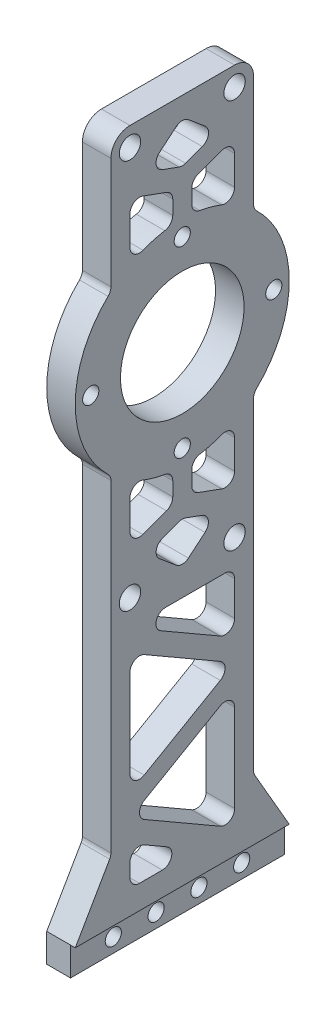
from build123d import *

# Parameters (mm, degrees)
SKETCH_1_W          = 6
SKETCH_1_H          = 30
EXTRUDE_1_DEPTH     = 177
SKETCH_2_R          = 22.5
EXTRUDE_2_DEPTH     = 6
SKETCH_3_R          = 13
CUT_EXTRUDE_1_DEPTH = 182.028312703
HOLE_WIZARD_M32_D   = 3.4
HOLE_WIZARD_M41_D   = 4.5
EXTRUDE_3_DEPTH     = 6
HOLE_WIZARD_M31_D   = 3.4
SKETCH_14_W         = 45
SKETCH_14_H         = 6
CUT_EXTRUDE_2_DEPTH = 1
SKETCH_15_W         = 30
SKETCH_15_H         = 26.9754548
CUT_EXTRUDE_3_DEPTH = 6
FILLET_1_R          = 4
CUT_EXTRUDE_4_DEPTH = 155.756628816
FILLET_3_R          = 2


with BuildPart() as part:
    # Эскиз1 → Бобышка-Вытянуть1 (new body)
    with BuildSketch(Plane(origin=(0, 0, 0), x_dir=(1, 0, 0), z_dir=(0, 1, 0))):
        with Locations((3, -15)):
            Rectangle(SKETCH_1_W, SKETCH_1_H)
    extrude(amount=EXTRUDE_1_DEPTH)

    # Эскиз2 → Бобышка-Вытянуть2 (add)
    with BuildSketch(Plane.ZY):
        with Locations((15, 105)):
            Circle(SKETCH_2_R)
    extrude(amount=-EXTRUDE_2_DEPTH)

    # Эскиз3 → Вырез-Вытянуть1 (cut, through all)
    with BuildSketch(Plane.ZY):
        with Locations((15, 105)):
            Circle(SKETCH_3_R)
    extrude(amount=-CUT_EXTRUDE_1_DEPTH, mode=Mode.SUBTRACT)

    # Отверстие с зазором M32 (through all)
    with Locations(Plane(origin=(6, -25.024735225, 7.262908886), x_dir=(0, 0, 1), z_dir=(1, 0, 0))):
        with Locations((-11.512908886, -130.024735225), (7.737091114, -110.774735225), (26.987091114, -130.024735225), (7.737091114, -149.274735225)):
            Hole(HOLE_WIZARD_M32_D / 2)

    # Отверстие с зазором M41 (through all)
    with Locations(Plane(origin=(6, 0, 0), x_dir=(0, 0, -1), z_dir=(1, 0, 0))):
        with Locations((-26, 146), (-4, 146), (-4, 64), (-26, 64)):
            Hole(HOLE_WIZARD_M41_D / 2)

    # Эскиз11 → Бобышка-Вытянуть3 (add)
    with BuildSketch(Plane(origin=(6, 0, 0), x_dir=(0, 0, -1), z_dir=(1, 0, 0))):
        Polygon((0, 18.990381057), (7.5, 6), (7.5, 0), (-37.5, 0), (-37.5, 6), (-30, 18.990381057), align=None)
    extrude(amount=-EXTRUDE_3_DEPTH)

    # Отверстие с зазором M31 (through all)
    with Locations(Plane(origin=(6, 0, 0), x_dir=(0, 0, -1), z_dir=(1, 0, 0))):
        with Locations((-28.5, 3), (-19.5, 3), (-10.5, 3), (-1.5, 3)):
            Hole(HOLE_WIZARD_M31_D / 2)

    # Эскиз14 → Вырез-Вытянуть2 (cut)
    with BuildSketch(Plane(origin=(6, 0, 0), x_dir=(0, 0, -1), z_dir=(1, 0, 0))):
        with Locations((-15, 3)):
            Rectangle(SKETCH_14_W, SKETCH_14_H)
    extrude(amount=-CUT_EXTRUDE_2_DEPTH, mode=Mode.SUBTRACT)

    # Эскиз15 → Вырез-Вытянуть3 (cut)
    with BuildSketch(Plane(origin=(6, 0, 0), x_dir=(0, 0, -1), z_dir=(1, 0, 0))):
        with Locations((-15, 163.5122726)):
            Rectangle(SKETCH_15_W, SKETCH_15_H)
    extrude(amount=-CUT_EXTRUDE_3_DEPTH, mode=Mode.SUBTRACT)

    # Скругление1
    fillet_1_edges = [part.edges().sort_by_distance(p)[0] for p in [
        (3, 150.0245452, 30),
        (3, 150.0245452, 0),
    ]]
    fillet(fillet_1_edges, radius=FILLET_1_R)

    # Эскиз16 → Вырез-Вытянуть4 (cut, through all)
    with BuildSketch(Plane.ZY):
        with BuildLine():
            Line((4, 136.794449257), (4, 124.627786426))
            ThreePointArc((4, 124.627786426), (8.352708916, 126.495662847), (13, 127.410934831))
            Line((13, 127.410934831), (13, 133.518717149))
            Line((13, 133.518717149), (4, 136.794449257))
        make_face()
        with BuildLine():
            Line((26, 136.794449257), (26, 124.627786426))
            ThreePointArc((26, 124.627786426), (21.647291084, 126.495662847), (17, 127.410934831))
            Line((17, 127.410934831), (17, 133.518717149))
            Line((17, 133.518717149), (26, 136.794449257))
        make_face()
        Polygon((7.538207724, 139.763358053), (15, 137.04748777), (22.461792276, 139.763358053), (15, 146.0245452), align=None)
        with BuildLine():
            Line((13, 76.479065169), (13, 82.589065169))
            ThreePointArc((13, 82.589065169), (8.352708916, 83.504337153), (4, 85.372213574))
            Line((4, 85.372213574), (4, 73.203333061))
            Line((4, 73.203333061), (13, 76.479065169))
        make_face()
        with BuildLine():
            Line((17, 76.479065169), (17, 82.589065169))
            ThreePointArc((17, 82.589065169), (21.647291084, 83.504337153), (26, 85.372213574))
            Line((26, 85.372213574), (26, 73.203333061))
            Line((26, 73.203333061), (17, 76.479065169))
        make_face()
        Polygon((7.560453217, 70.242520962), (15, 72.950294548), (22.439546783, 70.242520962), (15, 64), align=None)
        Polygon((26, 53.881197846), (26, 28.477786002), (4, 41.179491924), align=None)
        Polygon((4, 58.5), (26, 58.5), (4, 45.798294078), align=None)
        Polygon((4, 36.560689771), (26, 23.858983849), (4, 11.157277926), align=None)
        Polygon((11.72758664, 11), (26, 19.240181695), (26, 11), align=None)
    extrude(amount=-CUT_EXTRUDE_4_DEPTH, mode=Mode.SUBTRACT)

    # Скругление3
    fillet_3_edges = [part.edges().sort_by_distance(p)[0] for p in [
        (3, 88.229490169, 0),
        (3, 121.770509831, 0),
        (3, 127.410934831, 13),
        (3, 124.627786426, 4),
        (3, 136.794449257, 4),
        (3, 133.518717149, 13),
        (3, 88.229490169, 30),
        (3, 124.627786426, 26),
        (3, 121.770509831, 30),
        (3, 127.410934831, 17),
        (3, 133.518717149, 17),
        (3, 136.794449257, 26),
        (3, 146.0245452, 15),
        (3, 139.763358053, 22.461792276),
        (3, 137.04748777, 15),
        (3, 139.763358053, 7.538207724),
        (3, 76.479065169, 13),
        (3, 73.203333061, 4),
        (3, 85.372213574, 4),
        (3, 82.589065169, 13),
        (3, 73.203333061, 26),
        (3, 76.479065169, 17),
        (3, 82.589065169, 17),
        (3, 85.372213574, 26),
        (3, 64, 15),
        (3, 70.242520962, 7.560453217),
        (3, 72.950294548, 15),
        (3, 70.242520962, 22.439546783),
        (3, 41.179491924, 4),
        (3, 53.881197846, 26),
        (3, 28.477786002, 26),
        (3, 45.798294078, 4),
        (3, 58.5, 4),
        (3, 58.5, 26),
        (3, 11.157277926, 4),
        (3, 36.560689771, 4),
        (3, 23.858983849, 26),
        (3, 11, 26),
        (3, 11, 11.72758664),
        (3, 19.240181695, 26),
        (3, 18.990381057, 30),
        (3, 18.990381057, 0),
    ]]
    fillet(fillet_3_edges, radius=FILLET_3_R)


solid = part.part
